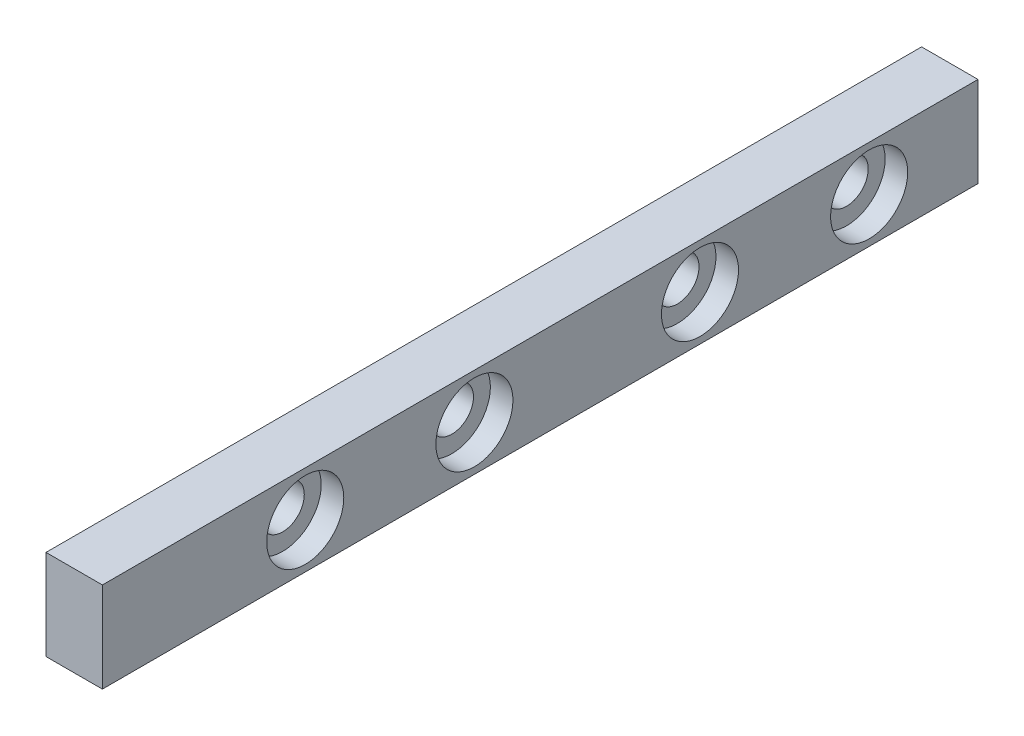
from build123d import *

# Parameters (mm, degrees)
SKETCH_1_W          = 41.58
SKETCH_1_H          = 4.8
SKETCH_1_R          = 1.15
EXTRUDE_1_DEPTH     = 3
SKETCH_2_R          = 2.05
CUT_EXTRUDE_1_DEPTH = 1.2
SKETCH_3_W          = 3
SKETCH_3_H          = 4.8
EXTRUDE_2_DEPTH     = 5


with BuildPart() as part:
    # 草图1 → 凸台-拉伸1 (new body)
    with BuildSketch(Plane(origin=(0, 0, 0), x_dir=(0, 0, -1), z_dir=(1, 0, 0))):
        with Locations((20.79, 2.4)):
            Rectangle(SKETCH_1_W, SKETCH_1_H)
        with Locations((14.79, 2.4)):
            Circle(SKETCH_1_R, mode=Mode.SUBTRACT)
        with Locations((5.79, 2.4)):
            Circle(SKETCH_1_R, mode=Mode.SUBTRACT)
        with Locations(Location((26.79, 2.4, 0), (0, 0, 180))):
            Circle(SKETCH_1_R, mode=Mode.SUBTRACT)
        with Locations(Location((35.79, 2.4, 0), (0, 0, 180))):
            Circle(SKETCH_1_R, mode=Mode.SUBTRACT)
    extrude(amount=EXTRUDE_1_DEPTH)

    # 草图2 → 切除-拉伸1 (cut)
    with BuildSketch(Plane(origin=(3, 0, 0), x_dir=(0, 0, -1), z_dir=(1, 0, 0))):
        with Locations((5.79, 2.4)):
            Circle(SKETCH_2_R)
        with Locations((14.79, 2.4)):
            Circle(SKETCH_2_R)
        with Locations((26.79, 2.4)):
            Circle(SKETCH_2_R)
        with Locations((35.79, 2.4)):
            Circle(SKETCH_2_R)
    extrude(amount=-CUT_EXTRUDE_1_DEPTH, mode=Mode.SUBTRACT)

    # 草图3 → 凸台-拉伸2 (add)
    with BuildSketch(Plane.XY):
        with Locations((1.5, 2.4)):
            Rectangle(SKETCH_3_W, SKETCH_3_H)
    extrude(amount=EXTRUDE_2_DEPTH)


solid = part.part
